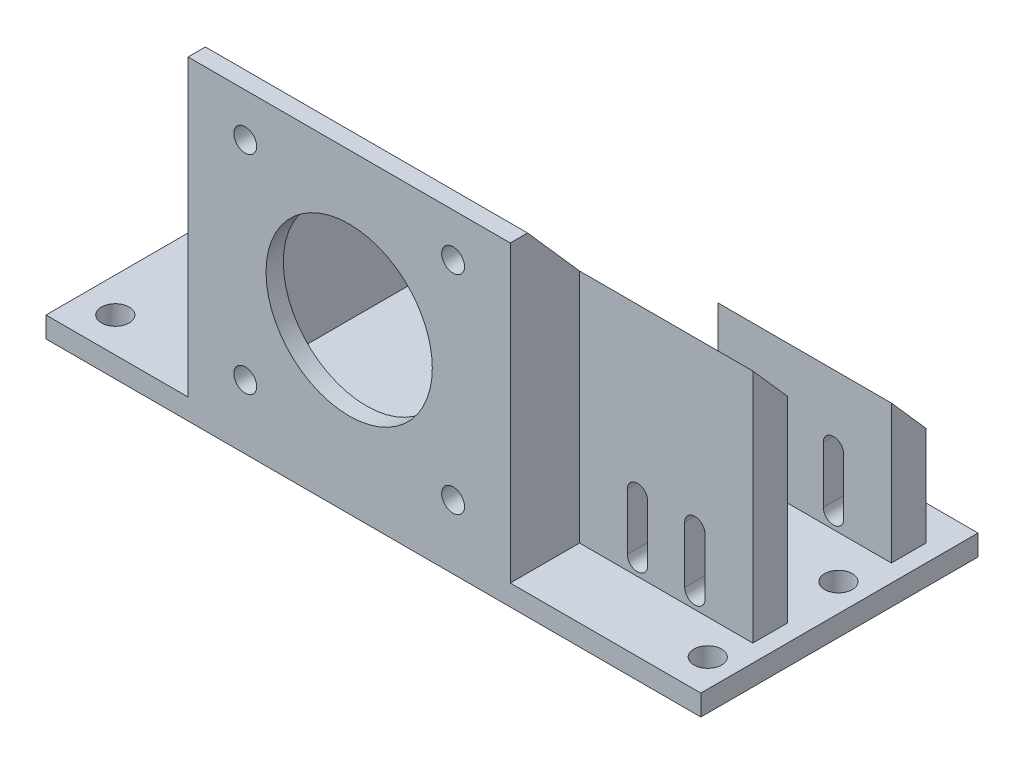
from build123d import *

# Parameters (mm, degrees)
SKETCH1_W           = 94.5
SKETCH1_H           = 40
SKETCH1_R           = 2
BOSS_EXTRUDE1_DEPTH = 3
BOSS_EXTRUDE2_DEPTH = 42.5
CUT_EXTRUDE1_DEPTH  = 88.459990853
SKETCH4_R           = 12
SKETCH4_R_2         = 1.65
CUT_EXTRUDE2_DEPTH  = 102.95219468
SKETCH7_W           = 25
SKETCH7_H           = 5
BOSS_EXTRUDE3_DEPTH = 20
BOSS_EXTRUDE4_REACH = 102.649
SKETCH7_3_W         = 25
SKETCH7_3_H         = 5
CUT_EXTRUDE3_DEPTH  = 99.459382488
CUT_EXTRUDE4_DEPTH  = 91.32856691


with BuildPart() as part:
    # Sketch1 → Boss-Extrude1 (new body)
    with BuildSketch(Plane(origin=(0, 0, 0), x_dir=(1, 0, 0), z_dir=(0, 1, 0))):
        with Locations((34.75, 20)):
            Rectangle(SKETCH1_W, SKETCH1_H)
        with Locations((78, 5)):
            Circle(SKETCH1_R, mode=Mode.SUBTRACT)
        with Locations((78, 23.86)):
            Circle(SKETCH1_R, mode=Mode.SUBTRACT)
        with Locations((-7.5, 23.86)):
            Circle(SKETCH1_R, mode=Mode.SUBTRACT)
        with Locations((-7.5, 5)):
            Circle(SKETCH1_R, mode=Mode.SUBTRACT)
    extrude(amount=BOSS_EXTRUDE1_DEPTH)

    # Sketch2 → Boss-Extrude2 (add)
    with BuildSketch(Plane(origin=(0, 3, 0), x_dir=(1, 0, 0), z_dir=(0, 1, 0))):
        Polygon((10, 2.5), (10, 40), (8, 40), (8, 0), (54.5, 0), (54.5, 40), (52.5, 40), (52.5, 2.5), align=None)
    extrude(amount=BOSS_EXTRUDE2_DEPTH)

    # Sketch3 → Cut-Extrude1 (cut, through all)
    with BuildSketch(Plane(origin=(54.5, 6, 0), x_dir=(0, 0, -1), z_dir=(-1, 0, 0))):
        Polygon((2.5, -39.5), (40, -39.5), (40, 3), align=None)
    extrude(amount=CUT_EXTRUDE1_DEPTH, mode=Mode.SUBTRACT)

    # Sketch4 → Cut-Extrude2 (cut, through all)
    with BuildSketch(Plane.XY):
        with Locations((31.25, 24.25)):
            Circle(SKETCH4_R)
        with Locations((16.25, 39.25)):
            Circle(SKETCH4_R_2)
        with Locations((16.25, 9.25)):
            Circle(SKETCH4_R_2)
        with Locations((46.25, 9.25)):
            Circle(SKETCH4_R_2)
        with Locations((46.25, 39.25)):
            Circle(SKETCH4_R_2)
    extrude(amount=-CUT_EXTRUDE2_DEPTH, mode=Mode.SUBTRACT)

    # Sketch7 → Boss-Extrude3 (add)
    with BuildSketch(Plane(origin=(0, 3, 0), x_dir=(1, 0, 0), z_dir=(0, 1, 0))):
        with Locations((67, 32.5)):
            Rectangle(SKETCH7_W, SKETCH7_H)
    extrude(amount=BOSS_EXTRUDE3_DEPTH)

    # Boss-Extrude4: up to this plane
    boss_extrude4_end = Plane(origin=(-12.5, 21.157587549, -23.978599222), z_dir=(0, -0.6616216370868465, 0.7498378553650924))
    # Sketch7<3> → Boss-Extrude4 (add, up to the surface)
    with BuildSketch(Plane(origin=(0, 3, 0), x_dir=(1, 0, 0), z_dir=(0, 1, 0)), mode=Mode.PRIVATE) as boss_extrude4_sk1:
        with Locations((67, 12.5)):
            Rectangle(SKETCH7_3_W, SKETCH7_3_H)
    boss_extrude4_tool1 = split(extrude(boss_extrude4_sk1.sketch, amount=BOSS_EXTRUDE4_REACH, mode=Mode.PRIVATE), bisect_by=boss_extrude4_end, keep=Keep.BOTH, mode=Mode.PRIVATE)
    add(boss_extrude4_tool1.solids().sort_by_distance((67, 3, -12.5))[0])

    # Sketch9 → Cut-Extrude3 (cut, through all)
    with BuildSketch(Plane.XY.offset(-10)):
        with BuildLine():
            Line((64.330095427, 5.052055091), (64.330095427, 13.170078856))
            ThreePointArc((64.330095427, 13.170078856), (62.856131757, 14.644042526), (61.382168087, 13.170078856))
            Line((61.382168087, 13.170078856), (61.382168087, 5.052055091))
            ThreePointArc((61.382168087, 5.052055091), (62.856131757, 3.578091421), (64.330095427, 5.052055091))
        make_face()
        with BuildLine():
            ThreePointArc((72.617831913, 13.170078856), (71.143868243, 14.644042526), (69.669904573, 13.170078856))
            Line((69.669904573, 13.170078856), (69.669904573, 5.052055091))
            ThreePointArc((69.669904573, 5.052055091), (71.143868243, 3.578091421), (72.617831913, 5.052055091))
            Line((72.617831913, 5.052055091), (72.617831913, 13.170078856))
        make_face()
    extrude(amount=-CUT_EXTRUDE3_DEPTH, mode=Mode.SUBTRACT)

    # Sketch11 → Cut-Extrude4 (cut, through all)
    with BuildSketch(Plane.ZY.offset(-54.5)):
        Polygon((-35, 17.332602518), (-30, 23), (-35, 23), align=None)
    extrude(amount=-CUT_EXTRUDE4_DEPTH, mode=Mode.SUBTRACT)


solid = part.part
